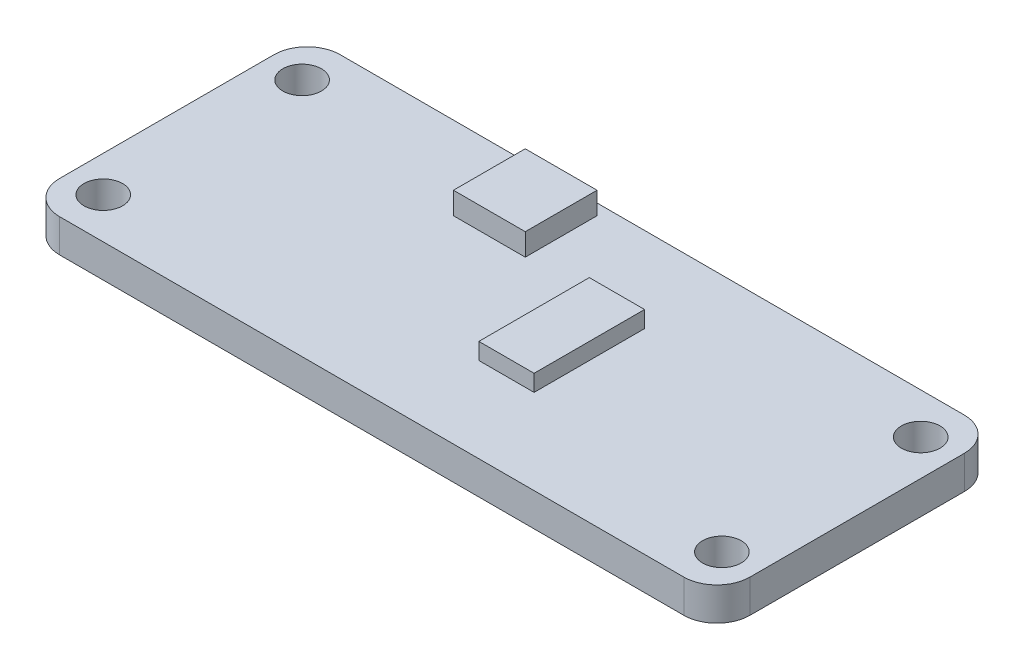
from build123d import *

# Parameters (mm, degrees)
SKETCH1_W           = 62.5
SKETCH1_H           = 25.4
BOSS_EXTRUDE1_DEPTH = 3
FILLET1_R           = 3
SKETCH2_R           = 1.75
CUT_EXTRUDE1_DEPTH  = 34.865210763
SKETCH6_W           = 6.5
SKETCH6_H           = 6.5
BOSS_EXTRUDE2_DEPTH = 2
SKETCH7_W           = 5
SKETCH7_H           = 10
BOSS_EXTRUDE3_DEPTH = 1.5


with BuildPart() as part:
    # Sketch1 → Boss-Extrude1 (new body)
    with BuildSketch(Plane(origin=(0, 0, 0), x_dir=(1, 0, 0), z_dir=(0, 1, 0))):
        Rectangle(SKETCH1_W, SKETCH1_H)
    extrude(amount=BOSS_EXTRUDE1_DEPTH)

    # Fillet1
    fillet1_edges = [part.edges().sort_by_distance(p)[0] for p in [
        (31.25, 1.5, 12.7),
        (-31.25, 1.5, 12.7),
        (-31.25, 1.5, -12.7),
        (31.25, 1.5, -12.7),
    ]]
    fillet(fillet1_edges, radius=FILLET1_R)

    # Sketch2 → Cut-Extrude1 (cut, through all)
    with BuildSketch(Plane(origin=(0, 3, 0), x_dir=(1, 0, 0), z_dir=(0, 1, 0))):
        with Locations(Location((-28, 9, 0), (0, 0, 270))):
            Circle(SKETCH2_R)
        with Locations(Location((28, 9, 0), (0, 0, 270))):
            Circle(SKETCH2_R)
        with Locations(Location((28, -9, 0), (0, 0, 270))):
            Circle(SKETCH2_R)
        with Locations(Location((-28, -9, 0), (0, 0, 270))):
            Circle(SKETCH2_R)
    extrude(amount=-CUT_EXTRUDE1_DEPTH, mode=Mode.SUBTRACT)

    # Sketch6 → Boss-Extrude2 (add)
    with BuildSketch(Plane(origin=(0, 3, 0), x_dir=(1, 0, 0), z_dir=(0, 1, 0))):
        with Locations((-7.25, 8.45)):
            Rectangle(SKETCH6_W, SKETCH6_H)
    extrude(amount=BOSS_EXTRUDE2_DEPTH)

    # Sketch7 → Boss-Extrude3 (add)
    with BuildSketch(Plane(origin=(0, 3, 0), x_dir=(1, 0, 0), z_dir=(0, 1, 0))):
        with Locations((4.5, 0)):
            Rectangle(SKETCH7_W, SKETCH7_H)
    extrude(amount=BOSS_EXTRUDE3_DEPTH)


solid = part.part
